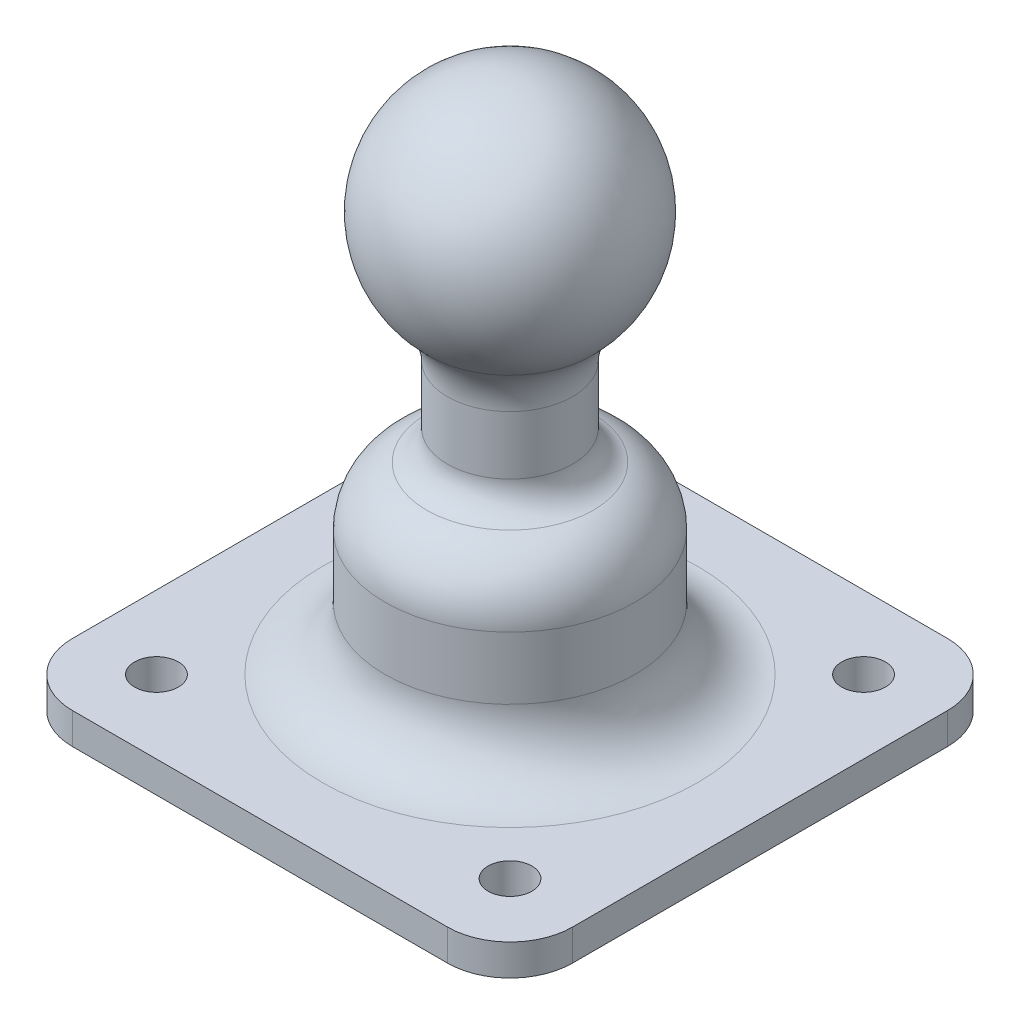
from build123d import *

# Parameters (mm, degrees)
SKETCH1_R           = 3.5
BOSS_EXTRUDE1_DEPTH = 5
SKETCH2_R           = 20
BOSS_EXTRUDE2_DEPTH = 30
FILLET1_R           = 10
SKETCH3_R           = 10
BOSS_EXTRUDE3_DEPTH = 20
FILLET2_R           = 5
FILLET3_R           = 10


with BuildPart() as part:
    # Sketch1 → Boss-Extrude1 (new body)
    with BuildSketch(Plane(origin=(0, 0, 0), x_dir=(1, 0, 0), z_dir=(0, 1, 0))):
        with BuildLine():
            Line((-30, 40), (30, 40))
            ThreePointArc((30, 40), (37.071067812, 37.071067812), (40, 30))
            Line((40, 30), (40, -30))
            ThreePointArc((40, -30), (37.071067812, -37.071067812), (30, -40))
            Line((30, -40), (-30, -40))
            ThreePointArc((-30, -40), (-37.071067812, -37.071067812), (-40, -30))
            Line((-40, -30), (-40, 30))
            ThreePointArc((-40, 30), (-37.071067812, 37.071067812), (-30, 40))
        make_face()
        with Locations(Location((-28.284271247, 28.284271247, 0), (0, 0, 270))):
            Circle(SKETCH1_R, mode=Mode.SUBTRACT)
        with Locations(Location((28.284271247, 28.284271247, 0), (0, 0, 270))):
            Circle(SKETCH1_R, mode=Mode.SUBTRACT)
        with Locations(Location((28.284271247, -28.284271247, 0), (0, 0, 270))):
            Circle(SKETCH1_R, mode=Mode.SUBTRACT)
        with Locations(Location((-28.284271247, -28.284271247, 0), (0, 0, 270))):
            Circle(SKETCH1_R, mode=Mode.SUBTRACT)
    extrude(amount=BOSS_EXTRUDE1_DEPTH)

    # Sketch2 → Boss-Extrude2 (add)
    with BuildSketch(Plane(origin=(0, 5, 0), x_dir=(1, 0, 0), z_dir=(0, 1, 0))):
        with Locations(Location((0, 0, 0), (0, 0, 270))):
            Circle(SKETCH2_R)
    extrude(amount=BOSS_EXTRUDE2_DEPTH)

    # Fillet1
    fillet1_edges = [part.edges().sort_by_distance(p)[0] for p in [
        (0, 5, -20),
        (0, 35, -20),
    ]]
    fillet(fillet1_edges, radius=FILLET1_R)

    # Sketch3 → Boss-Extrude3 (add)
    with BuildSketch(Plane(origin=(0, 35, 0), x_dir=(1, 0, 0), z_dir=(0, 1, 0))):
        with Locations(Location((0, 0, 0), (0, 0, 270))):
            Circle(SKETCH3_R)
    extrude(amount=BOSS_EXTRUDE3_DEPTH)

    # Fillet2
    fillet2_edges = [part.edges().sort_by_distance(p)[0] for p in [
        (0, 35, -10),
    ]]
    fillet(fillet2_edges, radius=FILLET2_R)

    # Sketch4 → Revolve1 (revolve)
    with BuildSketch(Plane.XY):
        with BuildLine():
            Line((0, 50.392135624), (0, 87.892135624))
            ThreePointArc((0, 87.892135624), (18.75, 69.142135624), (0, 50.392135624))
        make_face()
    revolve(axis=Axis((0, 55, 0), (0, 1, 0)))

    # Fillet3
    fillet3_edges = [part.edges().sort_by_distance(p)[0] for p in [
        (-7.071067812, 53.281413698, -7.071067812),
    ]]
    fillet(fillet3_edges, radius=FILLET3_R)


solid = part.part
